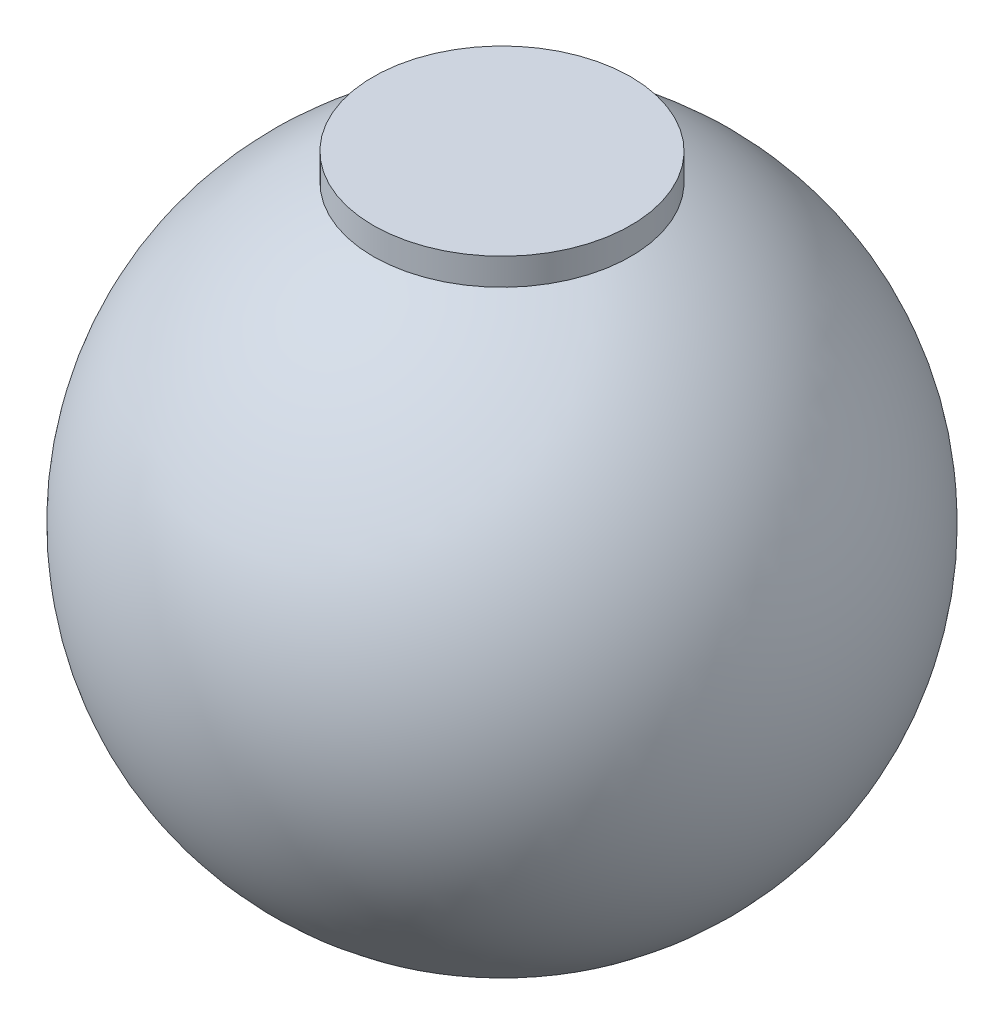
from build123d import *

# Parameters (mm, degrees)
SKETCH3_R           = 40
BOSS_EXTRUDE1_DEPTH = 100


with BuildPart() as part:
    # Sketch1 → Revolve1 (revolve)
    with BuildSketch(Plane(origin=(0, 0, 0), x_dir=(1, 0, 0), z_dir=(0, 1, 0))):
        with BuildLine():
            Line((0, 0), (0, -200))
            ThreePointArc((0, -200), (100, -100), (0, 0))
        make_face()
    revolve(axis=Axis((0, 0, 0), (0, 0, 1)))

    # Sketch3 → Boss-Extrude1 (add)
    with BuildSketch(Plane(origin=(0, 0, 0), x_dir=(1, 0, 0), z_dir=(0, 1, 0))):
        with Locations(Location((0, -100, 0), (0, 0, 90))):
            Circle(SKETCH3_R)
    extrude(amount=BOSS_EXTRUDE1_DEPTH)


solid = part.part
